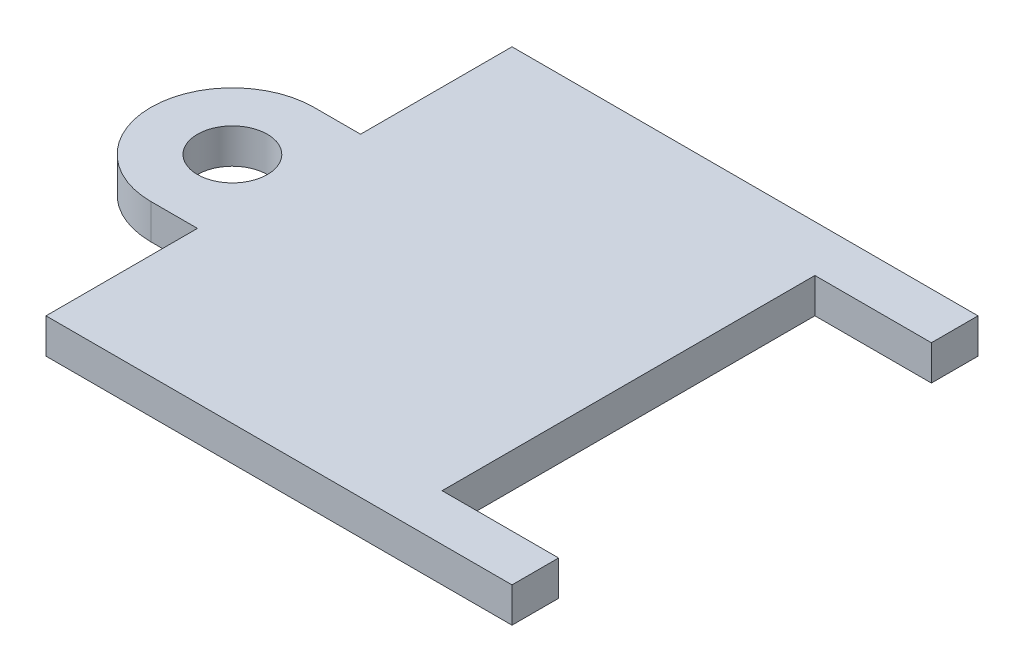
from build123d import *

# Parameters (mm, degrees)
SKETCH2_R           = 1.5
BOSS_EXTRUDE1_DEPTH = 1.5
SKETCH3_W           = 10.6
SKETCH3_H           = 15.6
BOSS_EXTRUDE2_DEPTH = 1.5


with BuildPart() as part:
    # Sketch2 → Boss-Extrude1 (new body)
    with BuildSketch(Plane(origin=(0, 0, 0), x_dir=(1, 0, 0), z_dir=(0, 1, 0))):
        with BuildLine():
            Line((15, 18), (15, 2))
            Line((15, 2), (20, 2))
            Line((20, 2), (20, 0))
            Line((20, 0), (15, 0))
            Line((15, 0), (0, 0))
            Line((0, 0), (0, 6.5))
            Line((0, 6.5), (-2, 6.5))
            ThreePointArc((-2, 6.5), (-5.5, 10), (-2, 13.5))
            Line((-2, 13.5), (0, 13.5))
            Line((0, 13.5), (0, 20))
            Line((0, 20), (15, 20))
            Line((15, 20), (20, 20))
            Line((20, 20), (20, 18))
            Line((20, 18), (15, 18))
        make_face()
        with Locations(Location((-2, 10, 0), (0, 0, 270))):
            Circle(SKETCH2_R, mode=Mode.SUBTRACT)
    extrude(amount=BOSS_EXTRUDE1_DEPTH)

    # Sketch3 → Boss-Extrude2 (add)
    with BuildSketch(Plane.XZ):
        with Locations((7.5, -10)):
            Rectangle(SKETCH3_W, SKETCH3_H)
    extrude(amount=BOSS_EXTRUDE2_DEPTH)


solid = part.part
